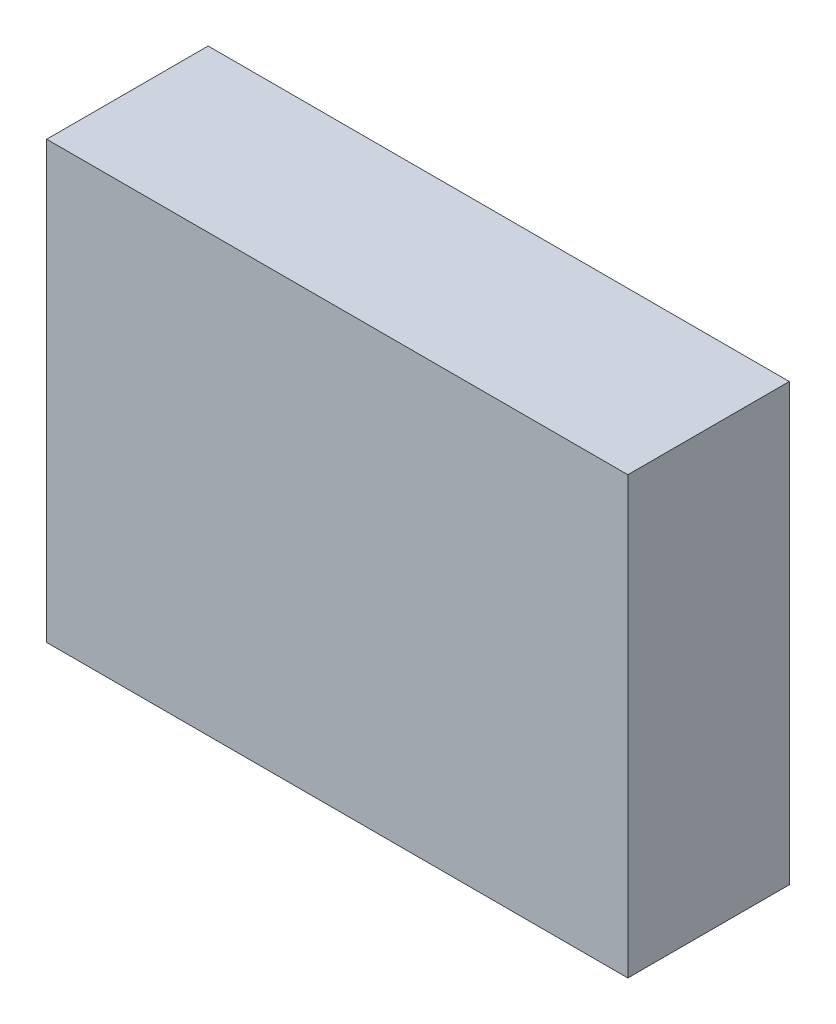
from build123d import *

# Parameters (mm, degrees)
SKETCH1_W           = 91.44
SKETCH1_H           = 68.58
BOSS_EXTRUDE1_DEPTH = 25.4


with BuildPart() as part:
    # Sketch1 → Boss-Extrude1 (new body)
    with BuildSketch(Plane.XY):
        with Locations((45.72, 34.29)):
            Rectangle(SKETCH1_W, SKETCH1_H)
    extrude(amount=BOSS_EXTRUDE1_DEPTH)


solid = part.part
